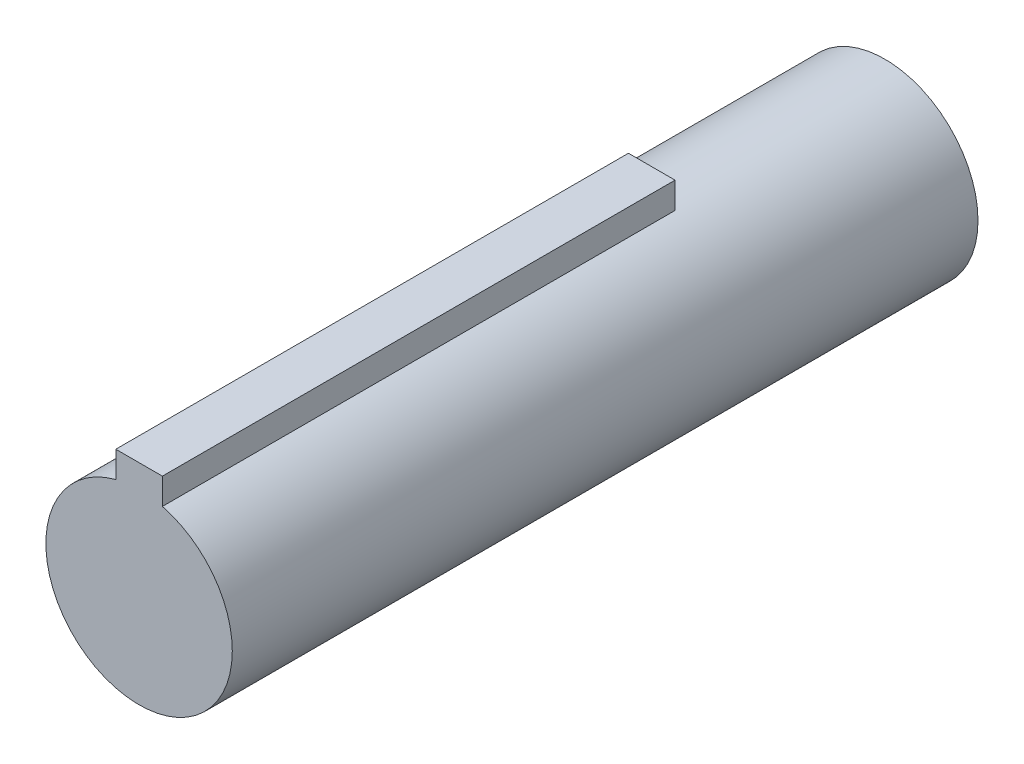
from build123d import *

# Parameters (mm, degrees)
EXTRUDE1_DEPTH      = 10
EXTRUDE1_DEPTH_BACK = 150
CUT_EXTRUDE1_DEPTH  = 50


with BuildPart() as part:
    # Sketch1 → Extrude1 (new, two sides: drawn at the far end of the back side and taken through both)
    with BuildSketch(Plane.XY.offset(-EXTRUDE1_DEPTH_BACK)):
        with BuildLine():
            Line((-5, 25), (-5, 19.364916731))
            ThreePointArc((-5, 19.364916731), (0, -20), (5, 19.364916731))
            Line((5, 19.364916731), (5, 25))
            Line((5, 25), (-5, 25))
        make_face()
    extrude(amount=EXTRUDE1_DEPTH + EXTRUDE1_DEPTH_BACK)

    # Sketch2 → Cut-Extrude1 (cut)
    with BuildSketch(Plane(origin=(0, 0, -150), x_dir=(-1, 0, 0), z_dir=(0, 0, -1))):
        with BuildLine():
            Line((-5, 19.364916731), (-5, 25))
            Line((-5, 25), (5, 25))
            Line((5, 25), (5, 19.364916731))
            ThreePointArc((5, 19.364916731), (0, 20), (-5, 19.364916731))
        make_face()
    extrude(amount=-CUT_EXTRUDE1_DEPTH, mode=Mode.SUBTRACT)


solid = part.part
